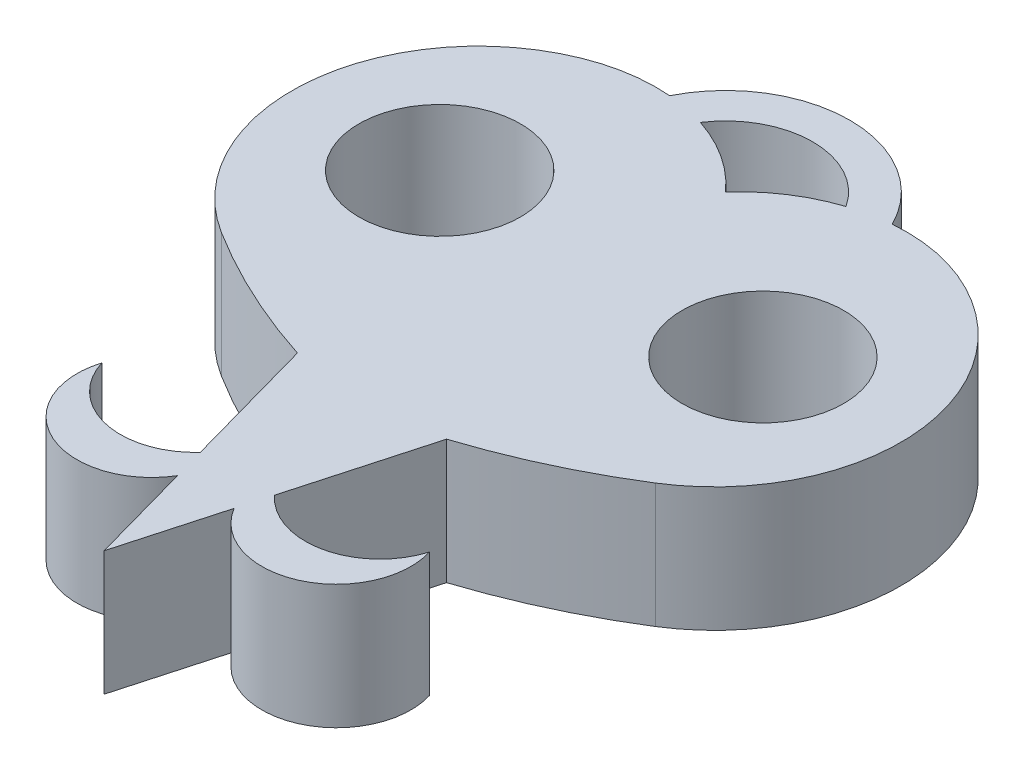
from build123d import *

# Parameters (mm, degrees)
SKETCH_1_R      = 6.5
EXTRUDE_3_DEPTH = 10
SCALE_1_SCALE   = 1.4


with BuildPart() as part:
    # 草图1 → 凸台-拉伸3 (new body)
    # profile 1 of 12: a face of its own
    with BuildSketch(Plane(origin=(0, 0, 0), x_dir=(1, 0, 0), z_dir=(0, 1, 0))):
        with BuildLine():
            ThreePointArc((5.859785995, 33.829217687), (7.388132252, 34.23249014), (8.953138838, 34.454357972))
            ThreePointArc((8.953138838, 34.454357972), (0, 40), (-8.953138838, 34.454357972))
            ThreePointArc((-8.953138838, 34.454357972), (-7.388132252, 34.23249014), (-5.859785995, 33.829217687))
            ThreePointArc((-5.859785995, 33.829217687), (0, 37), (5.859785995, 33.829217687))
        make_face()
    # profile 2 of 12: a face of its own
    with BuildSketch(Plane(origin=(0, 0, 0), x_dir=(1, 0, 0), z_dir=(0, 1, 0))):
        with BuildLine():
            ThreePointArc((0, 30), (7.005568982, 34.149386276), (15.123058987, 33.515541466))
            ThreePointArc((15.123058987, 33.515541466), (24.442500681, 20.921509808), (17.460562256, 6.896027189))
            ThreePointArc((17.460562256, 6.896027189), (11.894938122, 3.870741491), (6, 1.551640353))
            Line((6, 1.551640353), (0, -20))
            Line((0, -20), (-6, 1.551640353))
            ThreePointArc((-6, 1.551640353), (-11.894938122, 3.870741491), (-17.460562256, 6.896027189))
            ThreePointArc((-17.460562256, 6.896027189), (-24.442500681, 20.921509808), (-15.123058987, 33.515541466))
            ThreePointArc((-15.123058987, 33.515541466), (-7.005568982, 34.149386276), (0, 30))
        make_face()
        with Locations(Location((-13, 20, 0), (0, 0, 270))):
            Circle(SKETCH_1_R, mode=Mode.SUBTRACT)
        with Locations(Location((13, 20, 0), (0, 0, 270))):
            Circle(SKETCH_1_R, mode=Mode.SUBTRACT)
    # profile 3 of 12: a face of its own
    with BuildSketch(Plane(origin=(0, 0, 0), x_dir=(1, 0, 0), z_dir=(0, 1, 0))):
        with BuildLine():
            ThreePointArc((-1.7, -7), (-7.439120142, -11.25), (-13.178240283, -7))
            ThreePointArc((-13.178240283, -7), (-7.439120142, -14.75), (-1.7, -7))
        make_face()
    # profile 4 of 12: a face of its own
    with BuildSketch(Plane(origin=(0, 0, 0), x_dir=(1, 0, 0), z_dir=(0, 1, 0))):
        with BuildLine():
            ThreePointArc((1.7, -7), (7.439120142, -14.75), (13.178240283, -7))
            ThreePointArc((13.178240283, -7), (7.439120142, -11.25), (1.7, -7))
        make_face()
    # profile 5 of 12: a face of its own
    with BuildSketch(Plane(origin=(0, 0, 0), x_dir=(1, 0, 0), z_dir=(0, 1, 0))):
        with BuildLine():
            ThreePointArc((1.7, -7), (1.48214902, -9.46728311), (2.279456101, -11.812330319))
            Line((2.279456101, -11.812330319), (2.986703917, -9.271938557))
            ThreePointArc((2.986703917, -9.271938557), (2.218269676, -8.206809162), (1.7, -7))
        make_face()
    # profile 6 of 12: a face of its own
    with BuildSketch(Plane(origin=(0, 0, 0), x_dir=(1, 0, 0), z_dir=(0, 1, 0))):
        with BuildLine():
            Line((2.986703917, -9.271938557), (2.279456101, -11.812330319))
            ThreePointArc((2.279456101, -11.812330319), (9.862665709, -14.238754584), (13.178240283, -7))
            ThreePointArc((13.178240283, -7), (8.744619259, -11.106250682), (2.986703917, -9.271938557))
        make_face()
    # profile 7 of 12: a face of its own
    with BuildSketch(Plane(origin=(0, 0, 0), x_dir=(1, 0, 0), z_dir=(0, 1, 0))):
        with BuildLine():
            ThreePointArc((1.7, -7), (1.48214902, -9.46728311), (2.279456101, -11.812330319))
            Line((2.279456101, -11.812330319), (2.986703917, -9.271938557))
            ThreePointArc((2.986703917, -9.271938557), (2.218269676, -8.206809162), (1.7, -7))
        make_face()
    # profile 8 of 12: a face of its own
    with BuildSketch(Plane(origin=(0, 0, 0), x_dir=(1, 0, 0), z_dir=(0, 1, 0))):
        with BuildLine():
            Line((2.986703917, -9.271938557), (2.279456101, -11.812330319))
            ThreePointArc((2.279456101, -11.812330319), (9.862665709, -14.238754584), (13.178240283, -7))
            ThreePointArc((13.178240283, -7), (8.744619259, -11.106250682), (2.986703917, -9.271938557))
        make_face()
    # profile 9 of 12: a face of its own
    with BuildSketch(Plane(origin=(0, 0, 0), x_dir=(1, 0, 0), z_dir=(0, 1, 0))):
        with BuildLine():
            ThreePointArc((-13.178240283, -7), (-9.862665709, -14.238754584), (-2.279456101, -11.812330319))
            Line((-2.279456101, -11.812330319), (-2.986703917, -9.271938557))
            ThreePointArc((-2.986703917, -9.271938557), (-8.744619259, -11.106250682), (-13.178240283, -7))
        make_face()
    # profile 10 of 12: a face of its own
    with BuildSketch(Plane(origin=(0, 0, 0), x_dir=(1, 0, 0), z_dir=(0, 1, 0))):
        with BuildLine():
            Line((-2.986703917, -9.271938557), (-2.279456101, -11.812330319))
            ThreePointArc((-2.279456101, -11.812330319), (-1.48214902, -9.46728311), (-1.7, -7))
            ThreePointArc((-1.7, -7), (-2.218269676, -8.206809162), (-2.986703917, -9.271938557))
        make_face()
    # profile 11 of 12: a face of its own
    with BuildSketch(Plane(origin=(0, 0, 0), x_dir=(1, 0, 0), z_dir=(0, 1, 0))):
        with BuildLine():
            ThreePointArc((-13.178240283, -7), (-9.862665709, -14.238754584), (-2.279456101, -11.812330319))
            Line((-2.279456101, -11.812330319), (-2.986703917, -9.271938557))
            ThreePointArc((-2.986703917, -9.271938557), (-8.744619259, -11.106250682), (-13.178240283, -7))
        make_face()
    # profile 12 of 12: a face of its own
    with BuildSketch(Plane(origin=(0, 0, 0), x_dir=(1, 0, 0), z_dir=(0, 1, 0))):
        with BuildLine():
            Line((-2.986703917, -9.271938557), (-2.279456101, -11.812330319))
            ThreePointArc((-2.279456101, -11.812330319), (-1.48214902, -9.46728311), (-1.7, -7))
            ThreePointArc((-1.7, -7), (-2.218269676, -8.206809162), (-2.986703917, -9.271938557))
        make_face()
    extrude(amount=EXTRUDE_3_DEPTH)


with BuildPart() as part_1:
    # 缩放比例1: scaled about (0, 5, -14.807027766)
    add(part.part.scale(SCALE_1_SCALE).moved(Location((0, -2, 5.922811106))))


solid = part_1.part
